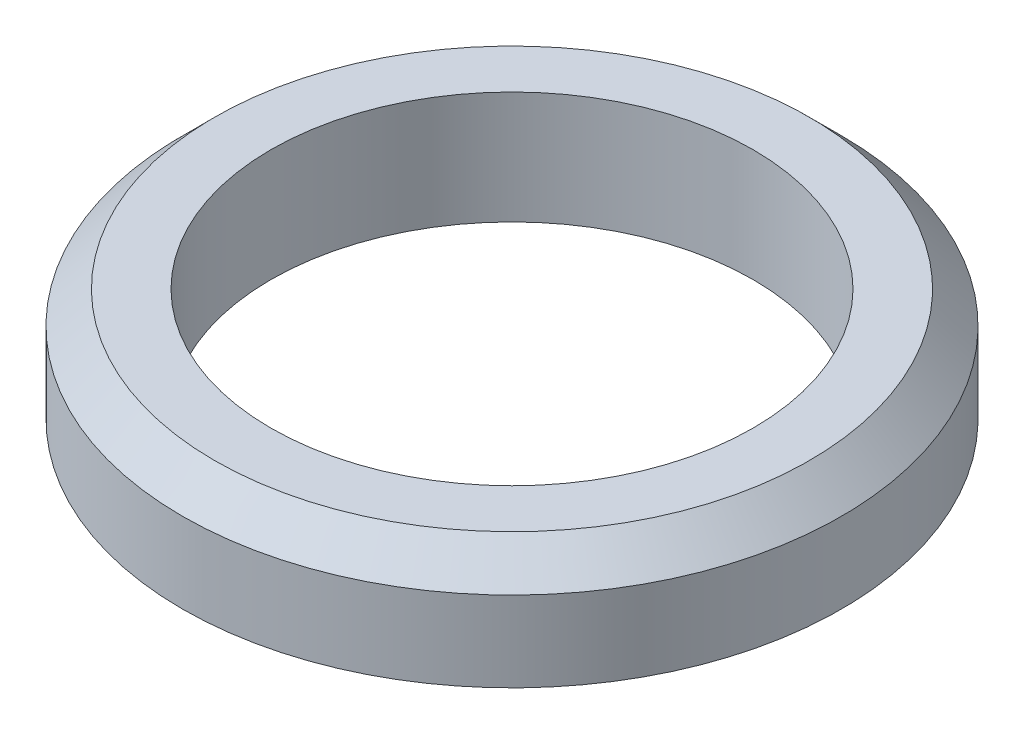
from build123d import *

# Parameters (mm, degrees)
SKETCH1_R           = 20.5
SKETCH1_R_2         = 15
BOSS_EXTRUDE1_DEPTH = 7
CHAMFER1_SIZE       = 2


with BuildPart() as part:
    # Sketch1 → Boss-Extrude1 (new body)
    with BuildSketch(Plane(origin=(0, 0, 0), x_dir=(1, 0, 0), z_dir=(0, 1, 0))):
        with Locations(Location((0, 0, 0), (0, 0, 270))):
            Circle(SKETCH1_R)
        with Locations(Location((0, 0, 0), (0, 0, 270))):
            Circle(SKETCH1_R_2, mode=Mode.SUBTRACT)
    extrude(amount=BOSS_EXTRUDE1_DEPTH)

    # Chamfer1
    chamfer1_edges = [part.edges().sort_by_distance(p)[0] for p in [
        (0, 7, -20.5),
    ]]
    chamfer(chamfer1_edges, length=CHAMFER1_SIZE)


solid = part.part
